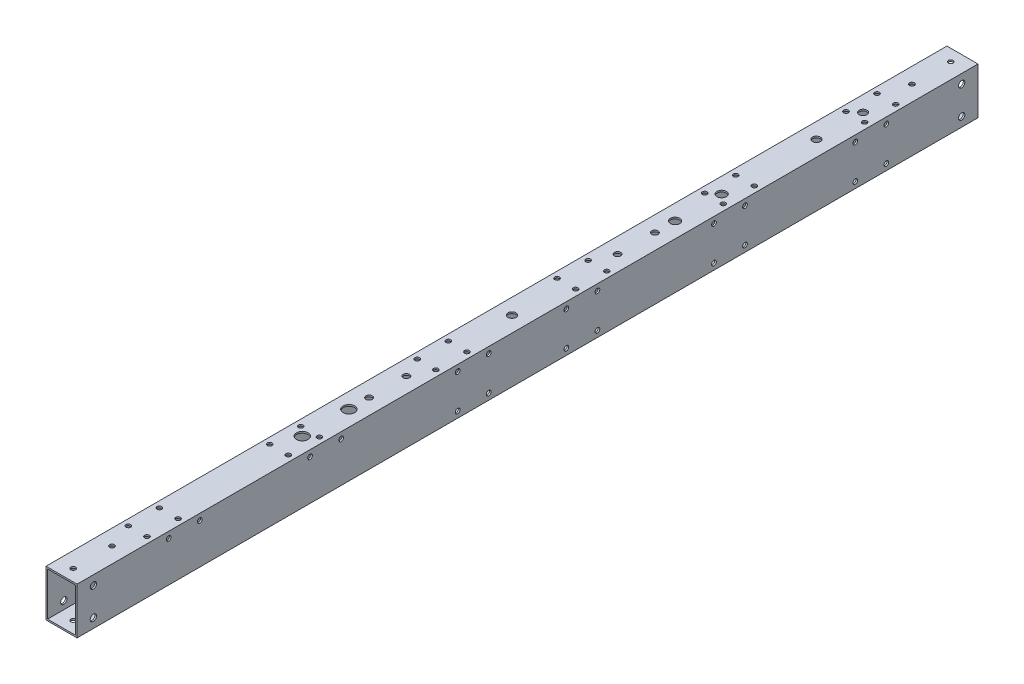
from build123d import *

# Parameters (mm, degrees)
SKETCH_1_W                                 = 20
SKETCH_1_H                                 = 30
SKETCH_1_W_2                               = 18
SKETCH_1_H_2                               = 28
EXTRUDE_1_DEPTH                            = 290
SKETCH_2_R                                 = 5
CUT_EXTRUDE_1_DEPTH                        = 10
SKETCH_3_R                                 = 2.6
CUT_EXTRUDE_2_DEPTH                        = 10
SKETCH_4_R                                 = 1.55
CUT_EXTRUDE_3_DEPTH                        = 40
SKETCH_5_R                                 = 2.025
CUT_EXTRUDE_4_DEPTH                        = 40
SKETCH_6_R                                 = 3.75
CUT_EXTRUDE_5_DEPTH                        = 4
SKETCH_7_R                                 = 2.025
CUT_EXTRUDE_6_DEPTH                        = 55
SKETCH_9_R                                 = 3
CUT_EXTRUDE_8_DEPTH                        = 3
SKETCH_10_R                                = 2.55
CUT_EXTRUDE_9_DEPTH                        = 30
SKETCH_12_R                                = 3.75
CUT_EXTRUDE_11_DEPTH                       = 3
SKETCH_13_R                                = 2.025
CUT_EXTRUDE_12_DEPTH                       = 3
SKETCH_14_R                                = 2.025
CUT_EXTRUDE_13_DEPTH                       = 30
SKETCH_15_R                                = 2.55
CUT_EXTRUDE_14_DEPTH                       = 5
SKETCH_16_R                                = 1.525
CUT_EXTRUDE_15_DEPTH                       = 40
SKETCH_17_R                                = 1.525
CUT_EXTRUDE_16_DEPTH                       = 40
PATTERN_LINEAR_1_COUNT                     = 2
PATTERN_LINEAR_1_PITCH                     = 91
PATTERN_LINEAR_1_COPY_1_SKETCH_R           = 1.525
PATTERN_LINEAR_1_COPY_1_DEPTH              = 40
PATTERN_LINEAR_1_COPY_2_SKETCH_R           = 1.525
PATTERN_LINEAR_1_COPY_2_DEPTH              = 40
MIRROR_7_COPY_1_SKETCH_R                   = 1.525
MIRROR_7_COPY_1_DEPTH                      = 40
MIRROR_7_COPY_2_SKETCH_R                   = 1.525
MIRROR_7_COPY_2_DEPTH                      = 40
MIRROR_7_COPY_3_SKETCH_R                   = 1.525
MIRROR_7_COPY_3_DEPTH                      = 40
MIRROR_7_COPY_4_SKETCH_R                   = 1.525
MIRROR_7_COPY_4_DEPTH                      = 40
MIRROR_7_COPY_5_SKETCH_R                   = 1.525
MIRROR_7_COPY_5_DEPTH                      = 40
MIRROR_7_COPY_6_SKETCH_R                   = 1.525
MIRROR_7_COPY_6_DEPTH                      = 40
SKETCH_18_R                                = 1.525
CUT_EXTRUDE_17_DEPTH                       = 40
SKETCH_19_R                                = 1.525
CUT_EXTRUDE_18_DEPTH                       = 10
MIRROR_8_AT_THE_SECOND_PLANE_COPY_1_SKET_R = 1.525
MIRROR_8_AT_THE_SECOND_PLANE_COPY_1_DEPTH  = 40
MIRROR_8_AT_THE_SECOND_PLANE_COPY_2_SKET_R = 1.525
MIRROR_8_AT_THE_SECOND_PLANE_COPY_2_DEPTH  = 10
MIRROR_9_COPY_1_SKETCH_R                   = 1.525
MIRROR_9_COPY_1_DEPTH                      = 40
MIRROR_9_COPY_2_SKETCH_R                   = 1.525
MIRROR_9_COPY_2_DEPTH                      = 40
MIRROR_9_COPY_3_SKETCH_R                   = 1.525
MIRROR_9_COPY_3_DEPTH                      = 40
MIRROR_9_COPY_4_SKETCH_R                   = 1.525
MIRROR_9_COPY_4_DEPTH                      = 40
MIRROR_9_COPY_5_SKETCH_R                   = 1.525
MIRROR_9_COPY_5_DEPTH                      = 40
MIRROR_9_COPY_6_SKETCH_R                   = 1.525
MIRROR_9_COPY_6_DEPTH                      = 40
MIRROR_9_COPY_7_SKETCH_R                   = 1.525
MIRROR_9_COPY_7_DEPTH                      = 10
MIRROR_9_COPY_8_SKETCH_R                   = 1.525
MIRROR_9_COPY_8_DEPTH                      = 40
MIRROR_9_COPY_9_SKETCH_R                   = 1.525
MIRROR_9_COPY_9_DEPTH                      = 10
MIRROR_9_COPY_10_SKETCH_R                  = 1.525
MIRROR_9_COPY_10_DEPTH                     = 40
MIRROR_9_COPY_11_SKETCH_R                  = 1.525
MIRROR_9_COPY_11_DEPTH                     = 10
MIRROR_9_COPY_12_SKETCH_R                  = 1.525
MIRROR_9_COPY_12_DEPTH                     = 40


with BuildPart() as part:
    # 草图1 → 凸台-拉伸1 (new, symmetric)
    with BuildSketch(Plane.XY):
        Rectangle(SKETCH_1_W, SKETCH_1_H)
        Rectangle(SKETCH_1_W_2, SKETCH_1_H_2, mode=Mode.SUBTRACT)
    extrude(amount=EXTRUDE_1_DEPTH, both=True)

    # 草图2 → 切除-拉伸1 (cut)
    with BuildSketch(Plane.XZ.offset(15)):
        with Locations(Location((0, 0, 0), (0, 0, 270))):
            Circle(SKETCH_2_R)
    extrude(amount=-CUT_EXTRUDE_1_DEPTH, mode=Mode.SUBTRACT)

    # 草图3 → 切除-拉伸2 (cut)
    with BuildSketch(Plane.XZ.offset(-14)):
        with Locations(Location((0, 0, 0), (0, 0, 270))):
            Circle(SKETCH_3_R)
    extrude(amount=-CUT_EXTRUDE_2_DEPTH, mode=Mode.SUBTRACT)

    # 草图4 → 切除-拉伸3 (cut)
    with BuildSketch(Plane(origin=(0, 15, 0), x_dir=(1, 0, 0), z_dir=(0, 1, 0))):
        with Locations(Location((0, 282.5, 0), (0, 0, 270))):
            Circle(SKETCH_4_R)
        with Locations(Location((0, 257.5, 0), (0, 0, 270))):
            Circle(SKETCH_4_R)
    cut_extrude_3 = extrude(amount=-CUT_EXTRUDE_3_DEPTH, mode=Mode.SUBTRACT)

    # 镜向1: 切除-拉伸3 across plane
    add(cut_extrude_3.mirror(Plane.XY), mode=Mode.SUBTRACT)

    # 草图5 → 切除-拉伸4 (cut)
    with BuildSketch(Plane(origin=(0, 15, 0), x_dir=(1, 0, 0), z_dir=(0, 1, 0))):
        with Locations(Location((0, 68, 0), (0, 0, 270))):
            Circle(SKETCH_5_R)
        with Locations(Location((0, 92, 0), (0, 0, 270))):
            Circle(SKETCH_5_R)
    cut_extrude_4 = extrude(amount=-CUT_EXTRUDE_4_DEPTH, mode=Mode.SUBTRACT)

    # 草图6 → 切除-拉伸5 (cut)
    with BuildSketch(Plane.XZ.offset(15)):
        with Locations(Location((0, -68, 0), (0, 0, 270))):
            Circle(SKETCH_6_R)
        with Locations(Location((0, -92, 0), (0, 0, 270))):
            Circle(SKETCH_6_R)
    cut_extrude_5 = extrude(amount=-CUT_EXTRUDE_5_DEPTH, mode=Mode.SUBTRACT)

    # 镜向2: 切除-拉伸4, 切除-拉伸5 across plane
    add(cut_extrude_4.mirror(Plane.XY), mode=Mode.SUBTRACT)
    add(cut_extrude_5.mirror(Plane.XY), mode=Mode.SUBTRACT)

    # 草图7 → 切除-拉伸6 (cut)
    with BuildSketch(Plane.XZ.offset(15)):
        with Locations(Location((0, -105, 0), (0, 0, 270))):
            Circle(SKETCH_7_R)
        with Locations(Location((0, -135, 0), (0, 0, 270))):
            Circle(SKETCH_7_R)
    extrude(amount=-CUT_EXTRUDE_6_DEPTH, mode=Mode.SUBTRACT)

    # 草图9 → 切除-拉伸8 (cut)
    with BuildSketch(Plane(origin=(0, 15, 0), x_dir=(1, 0, 0), z_dir=(0, 1, 0))):
        with Locations(Location((0, 105, 0), (0, 0, 270))):
            Circle(SKETCH_9_R)
        with Locations(Location((0, 135, 0), (0, 0, 270))):
            Circle(SKETCH_9_R)
    extrude(amount=-CUT_EXTRUDE_8_DEPTH, mode=Mode.SUBTRACT)

    # 草图10 → 切除-拉伸9 (cut)
    with BuildSketch(Plane(origin=(0, 15, 0), x_dir=(1, 0, 0), z_dir=(0, 1, 0))):
        with Locations(Location((0, 226, 0), (0, 0, 270))):
            Circle(SKETCH_10_R)
        with Locations(Location((0, 196, 0), (0, 0, 270))):
            Circle(SKETCH_10_R)
    extrude(amount=-CUT_EXTRUDE_9_DEPTH, mode=Mode.SUBTRACT)

    # 草图12 → 切除-拉伸11 (cut)
    with BuildSketch(Plane(origin=(0, 15, 0), x_dir=(1, 0, 0), z_dir=(0, 1, 0))):
        with Locations(Location((0, -105, 0), (0, 0, 270))):
            Circle(SKETCH_12_R)
        with Locations(Location((0, -135, 0), (0, 0, 270))):
            Circle(SKETCH_12_R)
    extrude(amount=-CUT_EXTRUDE_11_DEPTH, mode=Mode.SUBTRACT)

    # 草图13 → 切除-拉伸12 (cut)
    with BuildSketch(Plane(origin=(0, -14, 0), x_dir=(1, 0, 0), z_dir=(0, 1, 0))):
        with Locations(Location((0, -105, 0), (0, 0, 270))):
            Circle(SKETCH_13_R)
        with Locations(Location((0, -135, 0), (0, 0, 270))):
            Circle(SKETCH_13_R)
    extrude(amount=-CUT_EXTRUDE_12_DEPTH, mode=Mode.SUBTRACT)

    # 草图14 → 切除-拉伸13 (cut)
    with BuildSketch(Plane.ZY.offset(10)):
        with Locations((279.5, 9)):
            Circle(SKETCH_14_R)
        with Locations((279.5, -9)):
            Circle(SKETCH_14_R)
    cut_extrude_13 = extrude(amount=-CUT_EXTRUDE_13_DEPTH, mode=Mode.SUBTRACT)

    # 镜向3: 切除-拉伸13 across plane
    add(cut_extrude_13.mirror(Plane.XY), mode=Mode.SUBTRACT)

    # 草图15 → 切除-拉伸14 (cut, symmetric)
    with BuildSketch(Plane.XZ.offset(15)):
        with Locations(Location((0, 10, 0), (0, 0, 90))):
            Circle(SKETCH_15_R)
        with Locations(Location((0, -10, 0), (0, 0, 90))):
            Circle(SKETCH_15_R)
    extrude(amount=CUT_EXTRUDE_14_DEPTH, both=True, mode=Mode.SUBTRACT)

    # 草图16 → 切除-拉伸15 (cut)
    with BuildSketch(Plane.ZY.offset(10)):
        with Locations((-140, 11)):
            Circle(SKETCH_16_R)
        with Locations((-120, 11)):
            Circle(SKETCH_16_R)
    cut_extrude_15 = extrude(amount=-CUT_EXTRUDE_15_DEPTH, mode=Mode.SUBTRACT)

    # 草图17 → 切除-拉伸16 (cut)
    with BuildSketch(Plane(origin=(0, 15, 0), x_dir=(1, 0, 0), z_dir=(0, 1, 0))):
        with Locations(Location((-6, 130, 0), (0, 0, 270))):
            Circle(SKETCH_17_R)
        with Locations(Location((-6, 150, 0), (0, 0, 270))):
            Circle(SKETCH_17_R)
    cut_extrude_16 = extrude(amount=-CUT_EXTRUDE_16_DEPTH, mode=Mode.SUBTRACT)

    # 镜向4: 切除-拉伸15, 切除-拉伸16 across plane
    add(cut_extrude_15.mirror(Plane(origin=(0, 0, 0), x_dir=(0, 0, 1), z_dir=(1, 0, 0))), mode=Mode.SUBTRACT)
    add(cut_extrude_16.mirror(Plane(origin=(0, 0, 0), x_dir=(0, 0, 1), z_dir=(1, 0, 0))), mode=Mode.SUBTRACT)

    # 阵列(线性)1: 切除-拉伸15, 切除-拉伸16 ×2
    with Locations(*[(0, 0, -i * PATTERN_LINEAR_1_PITCH) for i in range(1, PATTERN_LINEAR_1_COUNT)]):
        add(cut_extrude_15, mode=Mode.SUBTRACT)
        add(cut_extrude_16, mode=Mode.SUBTRACT)

    # 阵列(线性)1 copy 1 sketch → 阵列(线性)1 copy 1 (cut)
    with BuildSketch(Plane(origin=(10, 0, -91), x_dir=(0, 0, 1), z_dir=(1, 0, 0))):
        with Locations((-140, -11)):
            Circle(PATTERN_LINEAR_1_COPY_1_SKETCH_R)
        with Locations((-120, -11)):
            Circle(PATTERN_LINEAR_1_COPY_1_SKETCH_R)
    extrude(amount=-PATTERN_LINEAR_1_COPY_1_DEPTH, mode=Mode.SUBTRACT)

    # 阵列(线性)1 copy 2 sketch → 阵列(线性)1 copy 2 (cut)
    with BuildSketch(Plane(origin=(0, 15, -91), x_dir=(-1, 0, 0), z_dir=(0, 1, 0))):
        with Locations((-6, -130)):
            Circle(PATTERN_LINEAR_1_COPY_2_SKETCH_R)
        with Locations((-6, -150)):
            Circle(PATTERN_LINEAR_1_COPY_2_SKETCH_R)
    extrude(amount=-PATTERN_LINEAR_1_COPY_2_DEPTH, mode=Mode.SUBTRACT)

    # 镜向7: 切除-拉伸15, 切除-拉伸16 across plane
    add(cut_extrude_15.mirror(Plane.XY), mode=Mode.SUBTRACT)
    add(cut_extrude_16.mirror(Plane.XY), mode=Mode.SUBTRACT)

    # 镜向7 copy 1 sketch → 镜向7 copy 1 (cut)
    with BuildSketch(Plane(origin=(10, 0, 0), x_dir=(0, 0, -1), z_dir=(1, 0, 0))):
        with Locations((-140, 11)):
            Circle(MIRROR_7_COPY_1_SKETCH_R)
        with Locations((-120, 11)):
            Circle(MIRROR_7_COPY_1_SKETCH_R)
    extrude(amount=-MIRROR_7_COPY_1_DEPTH, mode=Mode.SUBTRACT)

    # 镜向7 copy 2 sketch → 镜向7 copy 2 (cut)
    with BuildSketch(Plane(origin=(0, 15, 0), x_dir=(-1, 0, 0), z_dir=(0, 1, 0))):
        with Locations(Location((-6, 130, 0), (0, 0, 270))):
            Circle(MIRROR_7_COPY_2_SKETCH_R)
        with Locations(Location((-6, 150, 0), (0, 0, 270))):
            Circle(MIRROR_7_COPY_2_SKETCH_R)
    extrude(amount=-MIRROR_7_COPY_2_DEPTH, mode=Mode.SUBTRACT)

    # 镜向7 copy 3 sketch → 镜向7 copy 3 (cut)
    with BuildSketch(Plane(origin=(-10, 0, 91), x_dir=(0, 0, -1), z_dir=(-1, 0, 0))):
        with Locations((-140, -11)):
            Circle(MIRROR_7_COPY_3_SKETCH_R)
        with Locations((-120, -11)):
            Circle(MIRROR_7_COPY_3_SKETCH_R)
    extrude(amount=-MIRROR_7_COPY_3_DEPTH, mode=Mode.SUBTRACT)

    # 镜向7 copy 4 sketch → 镜向7 copy 4 (cut)
    with BuildSketch(Plane(origin=(0, 15, 91), x_dir=(1, 0, 0), z_dir=(0, 1, 0))):
        with Locations((-6, -130)):
            Circle(MIRROR_7_COPY_4_SKETCH_R)
        with Locations((-6, -150)):
            Circle(MIRROR_7_COPY_4_SKETCH_R)
    extrude(amount=-MIRROR_7_COPY_4_DEPTH, mode=Mode.SUBTRACT)

    # 镜向7 copy 5 sketch → 镜向7 copy 5 (cut)
    with BuildSketch(Plane(origin=(10, 0, 91), x_dir=(0, 0, -1), z_dir=(1, 0, 0))):
        with Locations((-140, 11)):
            Circle(MIRROR_7_COPY_5_SKETCH_R)
        with Locations((-120, 11)):
            Circle(MIRROR_7_COPY_5_SKETCH_R)
    extrude(amount=-MIRROR_7_COPY_5_DEPTH, mode=Mode.SUBTRACT)

    # 镜向7 copy 6 sketch → 镜向7 copy 6 (cut)
    with BuildSketch(Plane(origin=(0, 15, 91), x_dir=(-1, 0, 0), z_dir=(0, 1, 0))):
        with Locations(Location((-6, 130, 0), (0, 0, 270))):
            Circle(MIRROR_7_COPY_6_SKETCH_R)
        with Locations(Location((-6, 150, 0), (0, 0, 270))):
            Circle(MIRROR_7_COPY_6_SKETCH_R)
    extrude(amount=-MIRROR_7_COPY_6_DEPTH, mode=Mode.SUBTRACT)

    # 草图18 → 切除-拉伸17 (cut)
    with BuildSketch(Plane(origin=(0, 15, 0), x_dir=(1, 0, 0), z_dir=(0, 1, 0))):
        with Locations(Location((6, 55, 0), (0, 0, 270))):
            Circle(SKETCH_18_R)
        with Locations(Location((6, 35, 0), (0, 0, 270))):
            Circle(SKETCH_18_R)
    cut_extrude_17 = extrude(amount=-CUT_EXTRUDE_17_DEPTH, mode=Mode.SUBTRACT)

    # 草图19 → 切除-拉伸18 (cut)
    with BuildSketch(Plane(origin=(10, 0, 0), x_dir=(0, 0, -1), z_dir=(1, 0, 0))):
        with Locations(Location((45, 11, 0), (0, 0, 90))):
            Circle(SKETCH_19_R)
        with Locations(Location((25, 11, 0), (0, 0, 90))):
            Circle(SKETCH_19_R)
    cut_extrude_18 = extrude(amount=-CUT_EXTRUDE_18_DEPTH, mode=Mode.SUBTRACT)

    # 镜向8: 切除-拉伸17, 切除-拉伸18 across plane
    add(cut_extrude_17.mirror(Plane.XY), mode=Mode.SUBTRACT)
    add(cut_extrude_18.mirror(Plane.XY), mode=Mode.SUBTRACT)

    # 镜向8 at the second plane: 切除-拉伸17, 切除-拉伸18 across plane
    add(cut_extrude_17.mirror(Plane(origin=(0, 0, 0), x_dir=(0, 0, 1), z_dir=(1, 0, 0))), mode=Mode.SUBTRACT)
    add(cut_extrude_18.mirror(Plane(origin=(0, 0, 0), x_dir=(0, 0, 1), z_dir=(1, 0, 0))), mode=Mode.SUBTRACT)

    # 镜向8 at the second plane copy 1 sket → 镜向8 at the second plane copy 1 (cut)
    with BuildSketch(Plane(origin=(0, 15, 0), x_dir=(-1, 0, 0), z_dir=(0, 1, 0))):
        with Locations(Location((6, 55, 0), (0, 0, 270))):
            Circle(MIRROR_8_AT_THE_SECOND_PLANE_COPY_1_SKET_R)
        with Locations(Location((6, 35, 0), (0, 0, 270))):
            Circle(MIRROR_8_AT_THE_SECOND_PLANE_COPY_1_SKET_R)
    extrude(amount=-MIRROR_8_AT_THE_SECOND_PLANE_COPY_1_DEPTH, mode=Mode.SUBTRACT)

    # 镜向8 at the second plane copy 2 sket → 镜向8 at the second plane copy 2 (cut)
    with BuildSketch(Plane.ZY.offset(10)):
        with Locations(Location((45, 11, 0), (0, 0, 90))):
            Circle(MIRROR_8_AT_THE_SECOND_PLANE_COPY_2_SKET_R)
        with Locations(Location((25, 11, 0), (0, 0, 90))):
            Circle(MIRROR_8_AT_THE_SECOND_PLANE_COPY_2_SKET_R)
    extrude(amount=-MIRROR_8_AT_THE_SECOND_PLANE_COPY_2_DEPTH, mode=Mode.SUBTRACT)

    # 镜向9: 切除-拉伸15, 切除-拉伸18 across plane
    add(cut_extrude_15.mirror(Plane.ZX), mode=Mode.SUBTRACT)
    add(cut_extrude_18.mirror(Plane.ZX), mode=Mode.SUBTRACT)

    # 镜向9 copy 1 sketch → 镜向9 copy 1 (cut)
    with BuildSketch(Plane(origin=(-10, 0, -91), x_dir=(0, 0, 1), z_dir=(-1, 0, 0))):
        with Locations((-140, -11)):
            Circle(MIRROR_9_COPY_1_SKETCH_R)
        with Locations((-120, -11)):
            Circle(MIRROR_9_COPY_1_SKETCH_R)
    extrude(amount=-MIRROR_9_COPY_1_DEPTH, mode=Mode.SUBTRACT)

    # 镜向9 copy 2 sketch → 镜向9 copy 2 (cut)
    with BuildSketch(Plane(origin=(0, -15, -91), x_dir=(1, 0, 0), z_dir=(0, -1, 0))):
        with Locations((-6, -130)):
            Circle(MIRROR_9_COPY_2_SKETCH_R)
        with Locations((-6, -150)):
            Circle(MIRROR_9_COPY_2_SKETCH_R)
    extrude(amount=-MIRROR_9_COPY_2_DEPTH, mode=Mode.SUBTRACT)

    # 镜向9 copy 3 sketch → 镜向9 copy 3 (cut)
    with BuildSketch(Plane(origin=(10, 0, -91), x_dir=(0, 0, 1), z_dir=(1, 0, 0))):
        with Locations((-140, 11)):
            Circle(MIRROR_9_COPY_3_SKETCH_R)
        with Locations((-120, 11)):
            Circle(MIRROR_9_COPY_3_SKETCH_R)
    extrude(amount=-MIRROR_9_COPY_3_DEPTH, mode=Mode.SUBTRACT)

    # 镜向9 copy 4 sketch → 镜向9 copy 4 (cut)
    with BuildSketch(Plane(origin=(0, -15, -91), x_dir=(-1, 0, 0), z_dir=(0, -1, 0))):
        with Locations(Location((-6, 130, 0), (0, 0, 270))):
            Circle(MIRROR_9_COPY_4_SKETCH_R)
        with Locations(Location((-6, 150, 0), (0, 0, 270))):
            Circle(MIRROR_9_COPY_4_SKETCH_R)
    extrude(amount=-MIRROR_9_COPY_4_DEPTH, mode=Mode.SUBTRACT)

    # 镜向9 copy 5 sketch → 镜向9 copy 5 (cut)
    with BuildSketch(Plane.XZ.offset(15)):
        with Locations((-6, -130)):
            Circle(MIRROR_9_COPY_5_SKETCH_R)
        with Locations((-6, -150)):
            Circle(MIRROR_9_COPY_5_SKETCH_R)
    extrude(amount=-MIRROR_9_COPY_5_DEPTH, mode=Mode.SUBTRACT)

    # 镜向9 copy 6 sketch → 镜向9 copy 6 (cut)
    with BuildSketch(Plane.XZ.offset(15)):
        with Locations(Location((6, 55, 0), (0, 0, 270))):
            Circle(MIRROR_9_COPY_6_SKETCH_R)
        with Locations(Location((6, 35, 0), (0, 0, 270))):
            Circle(MIRROR_9_COPY_6_SKETCH_R)
    extrude(amount=-MIRROR_9_COPY_6_DEPTH, mode=Mode.SUBTRACT)

    # 镜向9 copy 7 sketch → 镜向9 copy 7 (cut)
    with BuildSketch(Plane(origin=(10, 0, 0), x_dir=(0, 0, 1), z_dir=(1, 0, 0))):
        with Locations(Location((45, 11, 0), (0, 0, 90))):
            Circle(MIRROR_9_COPY_7_SKETCH_R)
        with Locations(Location((25, 11, 0), (0, 0, 90))):
            Circle(MIRROR_9_COPY_7_SKETCH_R)
    extrude(amount=-MIRROR_9_COPY_7_DEPTH, mode=Mode.SUBTRACT)

    # 镜向9 copy 8 sketch → 镜向9 copy 8 (cut)
    with BuildSketch(Plane(origin=(0, -15, 0), x_dir=(-1, 0, 0), z_dir=(0, -1, 0))):
        with Locations(Location((6, 55, 0), (0, 0, 270))):
            Circle(MIRROR_9_COPY_8_SKETCH_R)
        with Locations(Location((6, 35, 0), (0, 0, 270))):
            Circle(MIRROR_9_COPY_8_SKETCH_R)
    extrude(amount=-MIRROR_9_COPY_8_DEPTH, mode=Mode.SUBTRACT)

    # 镜向9 copy 9 sketch → 镜向9 copy 9 (cut)
    with BuildSketch(Plane(origin=(-10, 0, 0), x_dir=(0, 0, -1), z_dir=(-1, 0, 0))):
        with Locations(Location((45, 11, 0), (0, 0, 90))):
            Circle(MIRROR_9_COPY_9_SKETCH_R)
        with Locations(Location((25, 11, 0), (0, 0, 90))):
            Circle(MIRROR_9_COPY_9_SKETCH_R)
    extrude(amount=-MIRROR_9_COPY_9_DEPTH, mode=Mode.SUBTRACT)

    # 镜向9 copy 10 sketch → 镜向9 copy 10 (cut)
    with BuildSketch(Plane(origin=(0, -15, 0), x_dir=(-1, 0, 0), z_dir=(0, -1, 0))):
        with Locations((6, -55)):
            Circle(MIRROR_9_COPY_10_SKETCH_R)
        with Locations((6, -35)):
            Circle(MIRROR_9_COPY_10_SKETCH_R)
    extrude(amount=-MIRROR_9_COPY_10_DEPTH, mode=Mode.SUBTRACT)

    # 镜向9 copy 11 sketch → 镜向9 copy 11 (cut)
    with BuildSketch(Plane.ZY.offset(10)):
        with Locations((45, -11)):
            Circle(MIRROR_9_COPY_11_SKETCH_R)
        with Locations((25, -11)):
            Circle(MIRROR_9_COPY_11_SKETCH_R)
    extrude(amount=-MIRROR_9_COPY_11_DEPTH, mode=Mode.SUBTRACT)

    # 镜向9 copy 12 sketch → 镜向9 copy 12 (cut)
    with BuildSketch(Plane.XZ.offset(15)):
        with Locations((6, -55)):
            Circle(MIRROR_9_COPY_12_SKETCH_R)
        with Locations((6, -35)):
            Circle(MIRROR_9_COPY_12_SKETCH_R)
    extrude(amount=-MIRROR_9_COPY_12_DEPTH, mode=Mode.SUBTRACT)


solid = part.part
